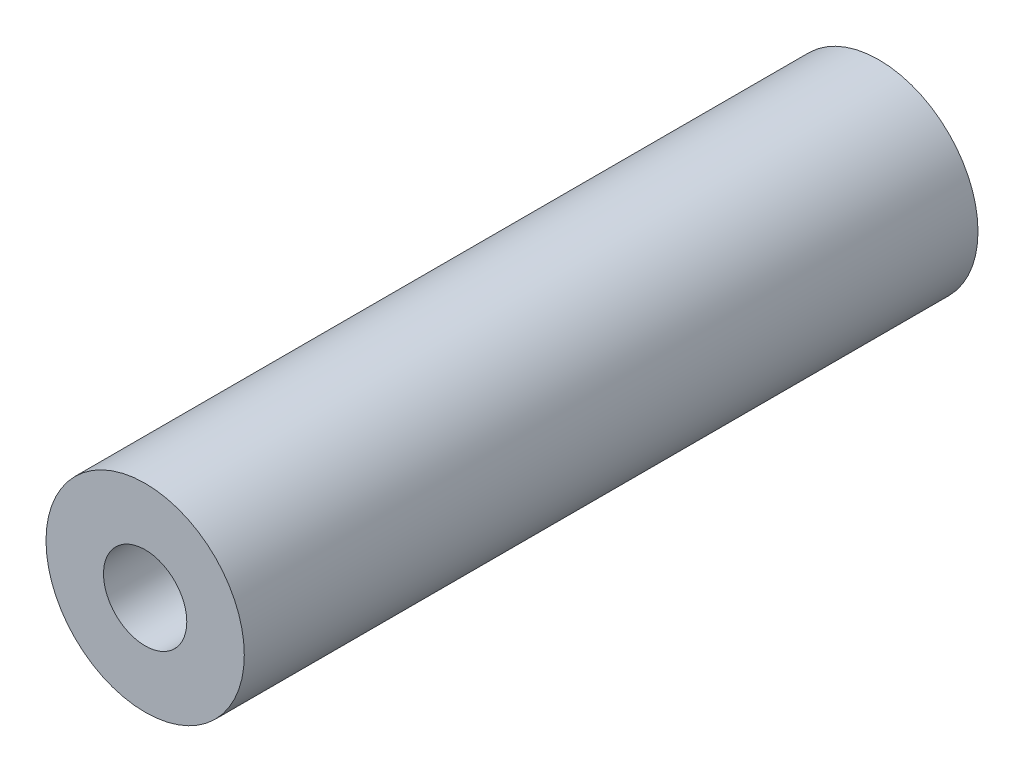
from build123d import *

# Parameters (mm, degrees)
SKETCH_1_R             = 5
EXTRUDE_1_DEPTH        = 37
HOLE_WIZARD_M5_1_D     = 4.2
HOLE_WIZARD_M5_1_DEPTH = 12.4
HOLE_WIZARD_M5_1_TIP   = 1.2618073
HOLE_WIZARD_M5_2_D     = 4.2
HOLE_WIZARD_M5_2_DEPTH = 12.4
HOLE_WIZARD_M5_2_TIP   = 1.2618073


with BuildPart() as part:
    # 草图1 → 凸台-拉伸1 (new body)
    with BuildSketch(Plane.XY):
        Circle(SKETCH_1_R)
    extrude(amount=EXTRUDE_1_DEPTH)

    # M5 螺纹孔1
    with Locations(Plane.XY.offset(37)):
        with Locations((0, 0)):
            Hole(HOLE_WIZARD_M5_1_D / 2, depth=HOLE_WIZARD_M5_1_DEPTH)
            with Locations((0, 0, -(HOLE_WIZARD_M5_1_DEPTH + HOLE_WIZARD_M5_1_TIP / 2))):  # 118° drill point
                Cone(0, HOLE_WIZARD_M5_1_D / 2, HOLE_WIZARD_M5_1_TIP, mode=Mode.SUBTRACT)

    # M5 螺纹孔2
    with Locations(Plane(origin=(0, 0, 0), x_dir=(-1, 0, 0), z_dir=(0, 0, -1))):
        with Locations((0, 0)):
            Hole(HOLE_WIZARD_M5_2_D / 2, depth=HOLE_WIZARD_M5_2_DEPTH)
            with Locations((0, 0, -(HOLE_WIZARD_M5_2_DEPTH + HOLE_WIZARD_M5_2_TIP / 2))):  # 118° drill point
                Cone(0, HOLE_WIZARD_M5_2_D / 2, HOLE_WIZARD_M5_2_TIP, mode=Mode.SUBTRACT)


solid = part.part
